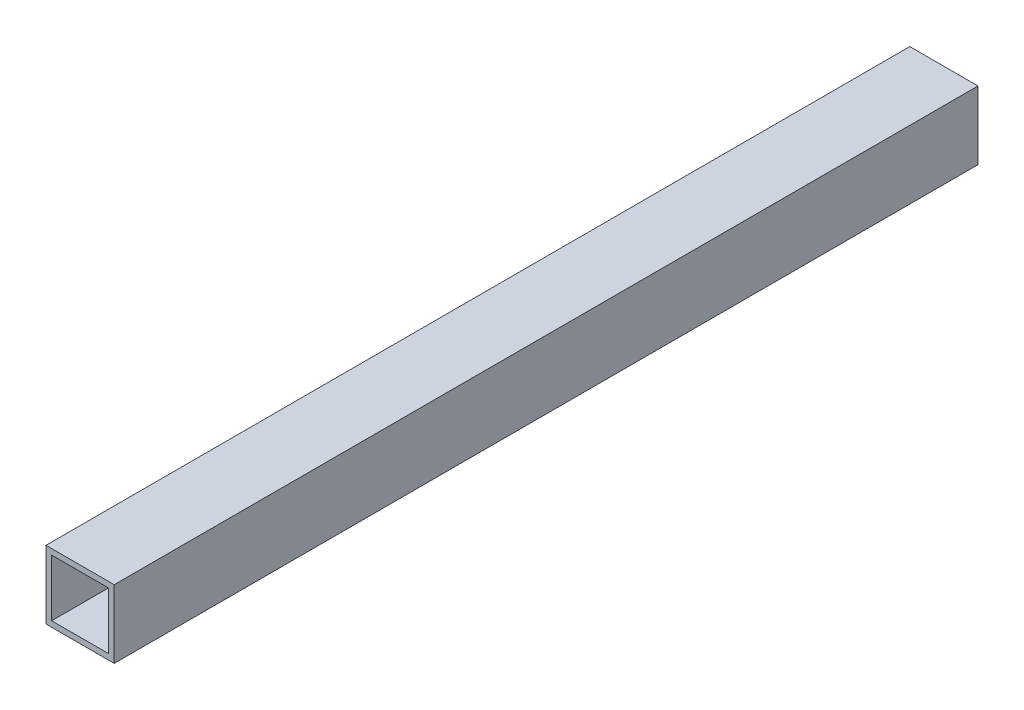
from build123d import *

# Parameters (mm, degrees)
BOSS_EXTRUDE1_DEPTH      = 241.3
BOSS_EXTRUDE1_DEPTH_BACK = 241.3
SKETCH3_W                = 38.1
SKETCH3_H                = 38.1
SKETCH3_W_2              = 31.75
SKETCH3_H_2              = 31.75


with BuildPart() as part:
    # Sketch3 → Boss-Extrude1 (new, two sides: drawn at the far end of the back side and taken through both)
    with BuildSketch(Plane.XY.offset(-BOSS_EXTRUDE1_DEPTH_BACK)):
        Rectangle(SKETCH3_W, SKETCH3_H)
        Rectangle(SKETCH3_W_2, SKETCH3_H_2, mode=Mode.SUBTRACT)
    extrude(amount=BOSS_EXTRUDE1_DEPTH + BOSS_EXTRUDE1_DEPTH_BACK)


solid = part.part
